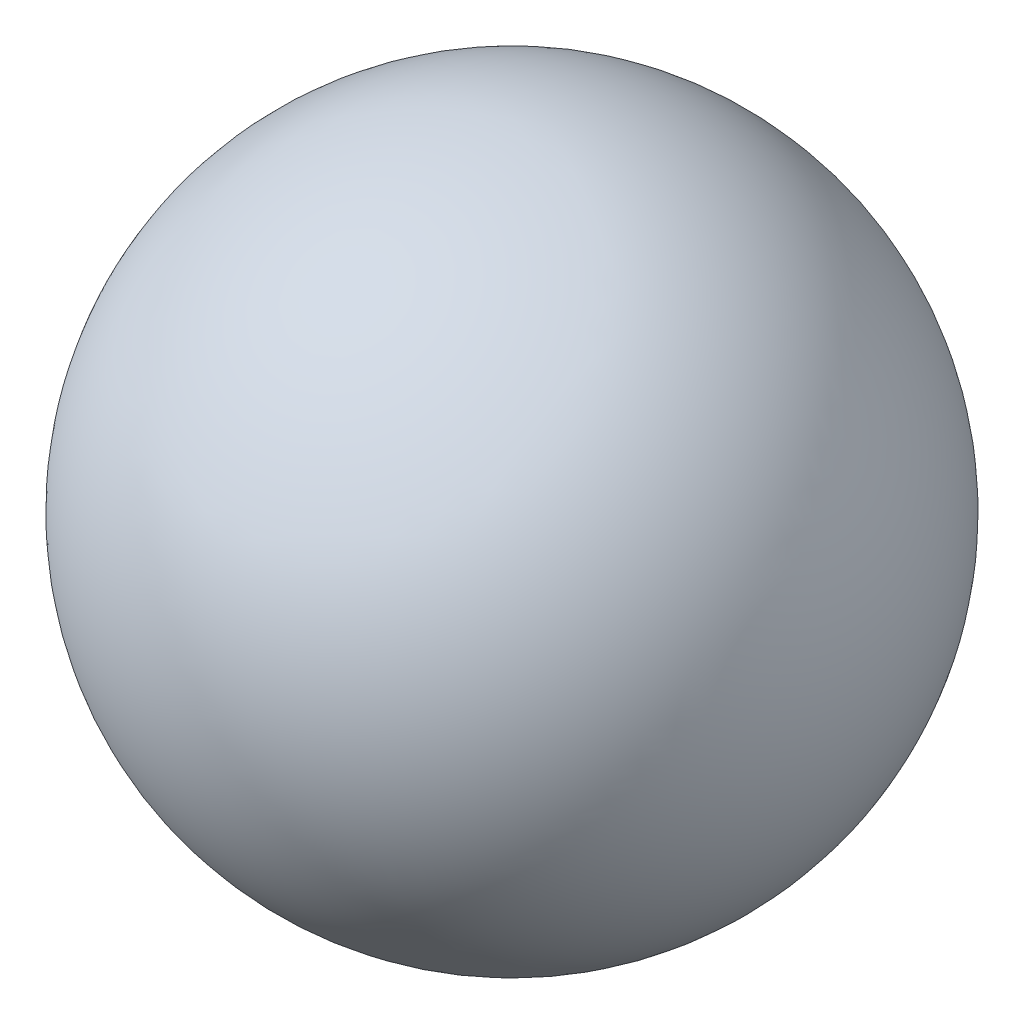
from build123d import *


with BuildPart() as part:
    # Skizze1 → Rotation1 (revolve)
    with BuildSketch(Plane.XY, mode=Mode.PRIVATE) as rotation1_sk:
        with BuildLine():
            Line((-2.598076211, 1.5), (0.401923789, 1.5))
            Line((0.401923789, 1.5), (1.199487936, 0))
            Line((1.199487936, 0), (3, 0))
            ThreePointArc((3, 0), (0.776457135, 2.897777479), (-2.598076211, 1.5))
        make_face()
    revolve(rotation1_sk.sketch.rotate(Axis((0, 0, 0), (-1, 0, 0)), 180), axis=Axis((0, 0, 0), (-1, 0, 0)))


solid = part.part
